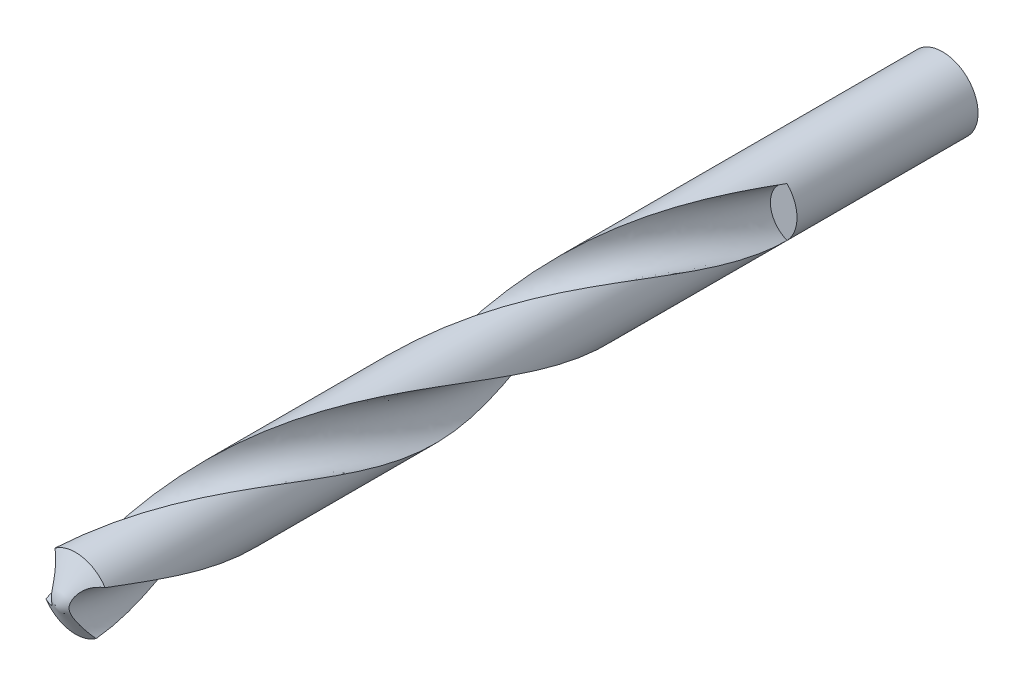
from build123d import *

# Parameters (mm, degrees)
SKETCH1_R           = 2
BOSS_EXTRUDE1_DEPTH = 60
CUT_SWEEP1_PITCH    = 39.8
CUT_SWEEP1_HEIGHT   = 39.8
CUT_SWEEP1_RADIUS   = 2
SKETCH7_R           = 1.5
CIRPATTERN1_COUNT   = 2
SKETCH9_R           = 2
CUT_EXTRUDE1_DEPTH  = 10


with BuildPart() as part:
    # Sketch1 → Boss-Extrude1 (new body)
    with BuildSketch(Plane.XY):
        Circle(SKETCH1_R)
    extrude(amount=BOSS_EXTRUDE1_DEPTH)

    # Cut-Sweep1: sweep along a helix
    with BuildLine() as cut_sweep1_path:
        Helix(CUT_SWEEP1_PITCH, CUT_SWEEP1_HEIGHT, CUT_SWEEP1_RADIUS, center=(0, 0, 60), direction=(0, 0, -1))
    # Sketch7 → Cut-Sweep1 (sweep, cut)
    with BuildSketch(Plane.XY.offset(60)):
        with Locations((-2, 0)):
            Circle(SKETCH7_R)
    cut_sweep1 = sweep(path=cut_sweep1_path.line, is_frenet=True, mode=Mode.SUBTRACT)

    # CirPattern1: Cut-Sweep1 ×2 about axis
    cirpattern1_axis = Axis((0, 0, 60), (0, 0, -1))
    for i in range(1, CIRPATTERN1_COUNT):
        add(cut_sweep1.rotate(cirpattern1_axis, i * 360 / CIRPATTERN1_COUNT), mode=Mode.SUBTRACT)

    # Sketch8 → Cut-Revolve1 (revolve, cut)
    with BuildSketch(Plane(origin=(0, 0, 0), x_dir=(1, 0, 0), z_dir=(0, 1, 0)), mode=Mode.PRIVATE) as cut_revolve1_sk:
        Polygon((0, -60), (-2.755473463, -58.409126655), (-2.755473463, -61.543289834), (0, -61.543289834), align=None)
    revolve(cut_revolve1_sk.sketch.rotate(Axis((0, 0, 60), (0, 0, -1)), 326.388786656), axis=Axis((0, 0, 60), (0, 0, -1)), mode=Mode.SUBTRACT)

    # Sketch9 → Cut-Extrude1 (cut)
    with BuildSketch(Plane(origin=(0, 0, 0), x_dir=(-1, 0, 0), z_dir=(0, 0, -1))):
        Circle(SKETCH9_R)
    extrude(amount=-CUT_EXTRUDE1_DEPTH, mode=Mode.SUBTRACT)


solid = part.part
